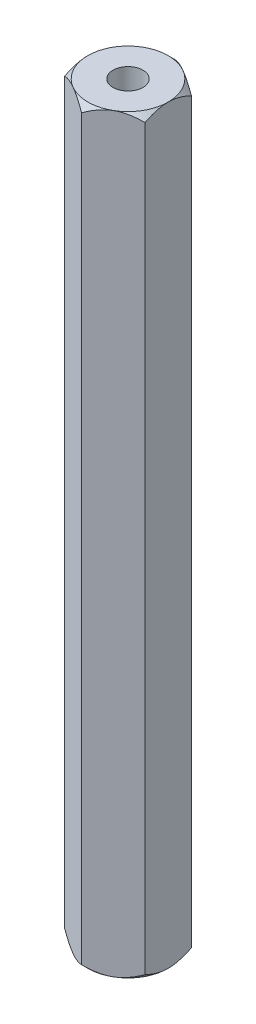
from build123d import *

# Parameters (mm, degrees)
SKETCH5_R             = 3.175
CUT_EXTRUDE1_DEPTH    = 45.676210112
F_2_56_TAPPED_HOLE1_D = 1.778


with BuildPart() as part:
    # Sketch1 → Revolve1 (revolve)
    with BuildSketch(Plane.XY, mode=Mode.PRIVATE) as revolve1_sk:
        Polygon((0, -22.225), (2.38125, -22.225), (3.175, -21.43125), (3.175, 21.43125), (2.38125, 22.225), (0, 22.225), align=None)
    revolve(revolve1_sk.sketch.rotate(Axis((0, -22.225, 0), (0, 1, 0)), 90), axis=Axis((0, -22.225, 0), (0, 1, 0)))

    # Sketch5 → Cut-Extrude1 (cut, through all)
    with BuildSketch(Plane(origin=(0, 22.225, 0), x_dir=(1, 0, 0), z_dir=(0, 1, 0))):
        Circle(SKETCH5_R)
        Polygon((2.38125, -1.374815329), (2.38125, 1.374815329), (0, 2.749630657), (-2.38125, 1.374815329), (-2.38125, -1.374815329), (0, -2.749630657), align=None, mode=Mode.SUBTRACT)
    extrude(amount=-CUT_EXTRUDE1_DEPTH, mode=Mode.SUBTRACT)

    # #2-56 Tapped Hole1 (through all)
    with Locations(Plane(origin=(0, -22.225, 0), x_dir=(-1, 0, 0), z_dir=(0, -1, 0))):
        with Locations((0, 0)):
            Hole(F_2_56_TAPPED_HOLE1_D / 2)


solid = part.part
